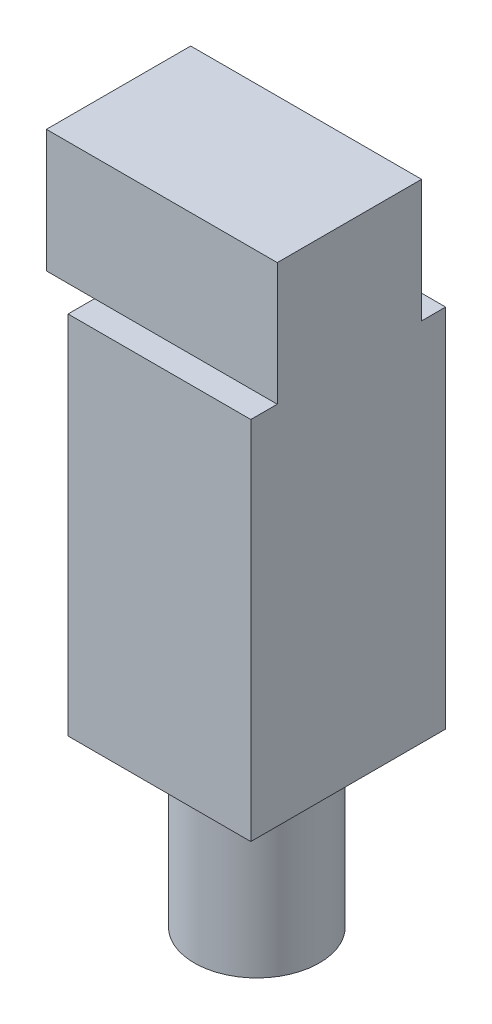
from build123d import *

# Parameters (mm, degrees)
SKETCH1_W           = 40.5
SKETCH1_H           = 76
BOSS_EXTRUDE1_DEPTH = 19
SKETCH2_R           = 13
BOSS_EXTRUDE2_DEPTH = 35
SKETCH3_W           = 48
SKETCH3_H           = 25.5
BOSS_EXTRUDE3_DEPTH = 30
SKETCH4_R           = 4.5
BOSS_EXTRUDE4_DEPTH = 5


with BuildPart() as part:
    # Sketch1 → Boss-Extrude1 (new, symmetric)
    with BuildSketch(Plane(origin=(0, 0, 0), x_dir=(0, 0, -1), z_dir=(1, 0, 0))):
        Rectangle(SKETCH1_W, SKETCH1_H)
    extrude(amount=BOSS_EXTRUDE1_DEPTH, both=True)

    # Sketch2 → Boss-Extrude2 (add)
    with BuildSketch(Plane.XZ.offset(38)):
        with Locations(Location((0, 0, 0), (0, 0, 270))):
            Circle(SKETCH2_R)
    extrude(amount=BOSS_EXTRUDE2_DEPTH)

    # Sketch3 → Boss-Extrude3 (add)
    with BuildSketch(Plane(origin=(0, 0, -15.25), x_dir=(-1, 0, 0), z_dir=(0, 0, -1))):
        with Locations((5, 50.75)):
            Rectangle(SKETCH3_W, SKETCH3_H)
    extrude(amount=-BOSS_EXTRUDE3_DEPTH)

    # Sketch4 → Boss-Extrude4 (add)
    with BuildSketch(Plane.ZY.offset(29)):
        with Locations(Location((0, 53.5, 0), (0, 0, 270))):
            Circle(SKETCH4_R)
    extrude(amount=BOSS_EXTRUDE4_DEPTH)


solid = part.part
